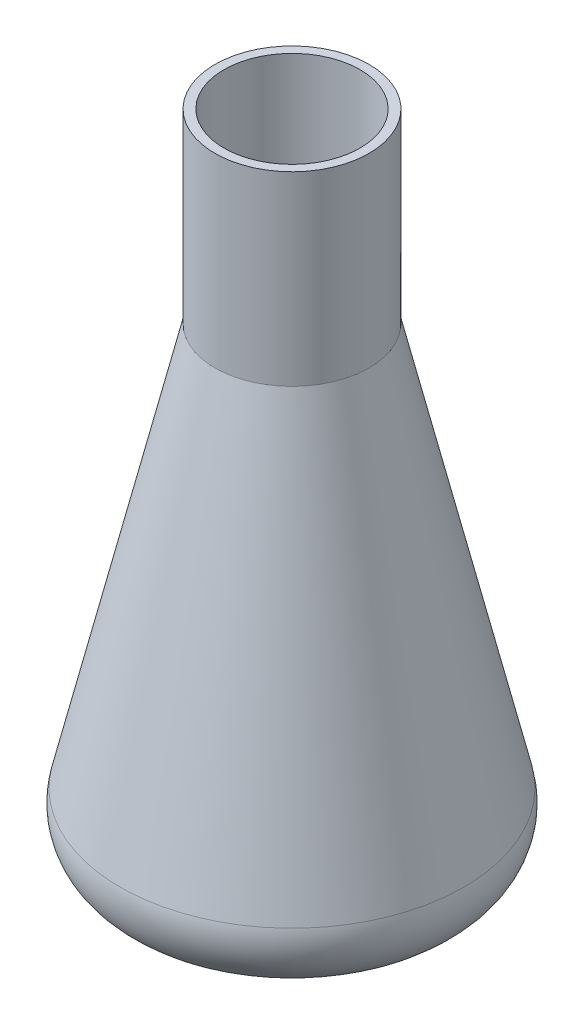
from build123d import *


with BuildPart() as part:
    # Croquis2 → Revolución1 (revolve)
    with BuildSketch(Plane.XY, mode=Mode.PRIVATE) as revoluci_n1_sk:
        with BuildLine():
            Line((17, 145), (17, 104))
            Line((17, 104), (37.898418039, 15.288347915))
            ThreePointArc((37.898418039, 15.288347915), (35.543424025, 4.716396984), (25.793155167, 0))
            Line((25.793155167, 0), (0, 0))
            Line((0, 0), (0, 2))
            Line((0, 2), (24.225162721, 2))
            ThreePointArc((24.225162721, 2), (33.380794894, 6.428759514), (35.592165604, 16.355962086))
            Line((35.592165604, 16.355962086), (15, 103.767603835))
            Line((15, 103.767603835), (15, 145))
            Line((15, 145), (17, 145))
        make_face()
    revolve(revoluci_n1_sk.sketch.rotate(Axis((0, 0, 0), (0, 1, 0)), 90), axis=Axis((0, 0, 0), (0, 1, 0)))


solid = part.part
